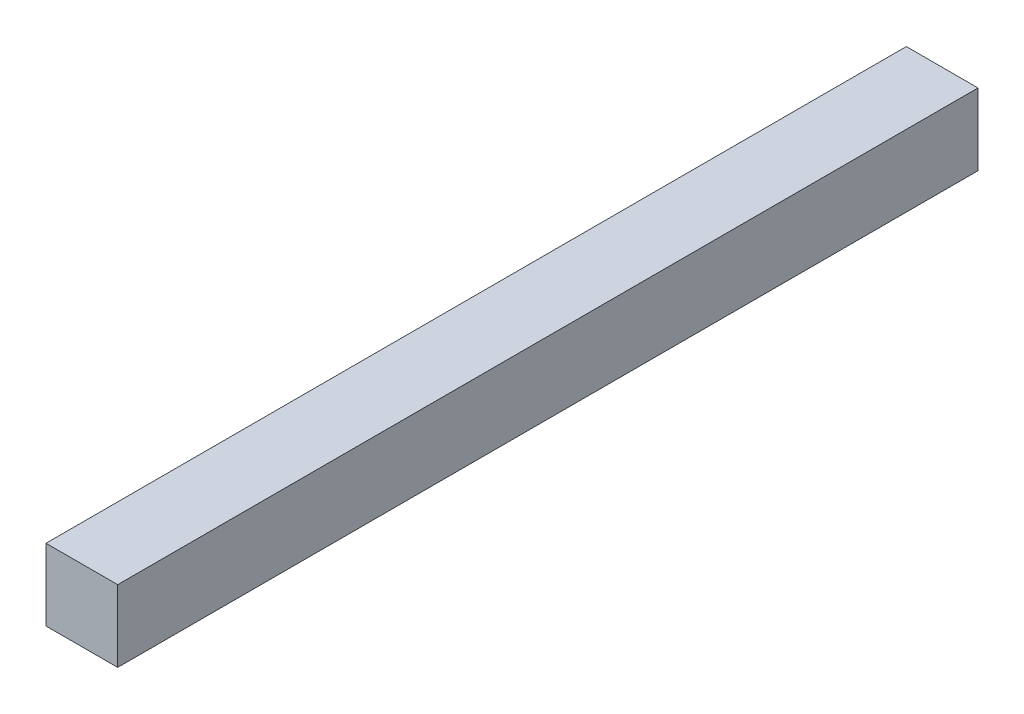
from build123d import *

# Parameters (mm, degrees)
SKETCH1_W           = 6.35
SKETCH1_H           = 6.35
BOSS_EXTRUDE1_DEPTH = 76.2


with BuildPart() as part:
    # Sketch1 → Boss-Extrude1 (new body)
    with BuildSketch(Plane.XY):
        with Locations((3.175, 3.175)):
            Rectangle(SKETCH1_W, SKETCH1_H)
    extrude(amount=BOSS_EXTRUDE1_DEPTH)


solid = part.part
